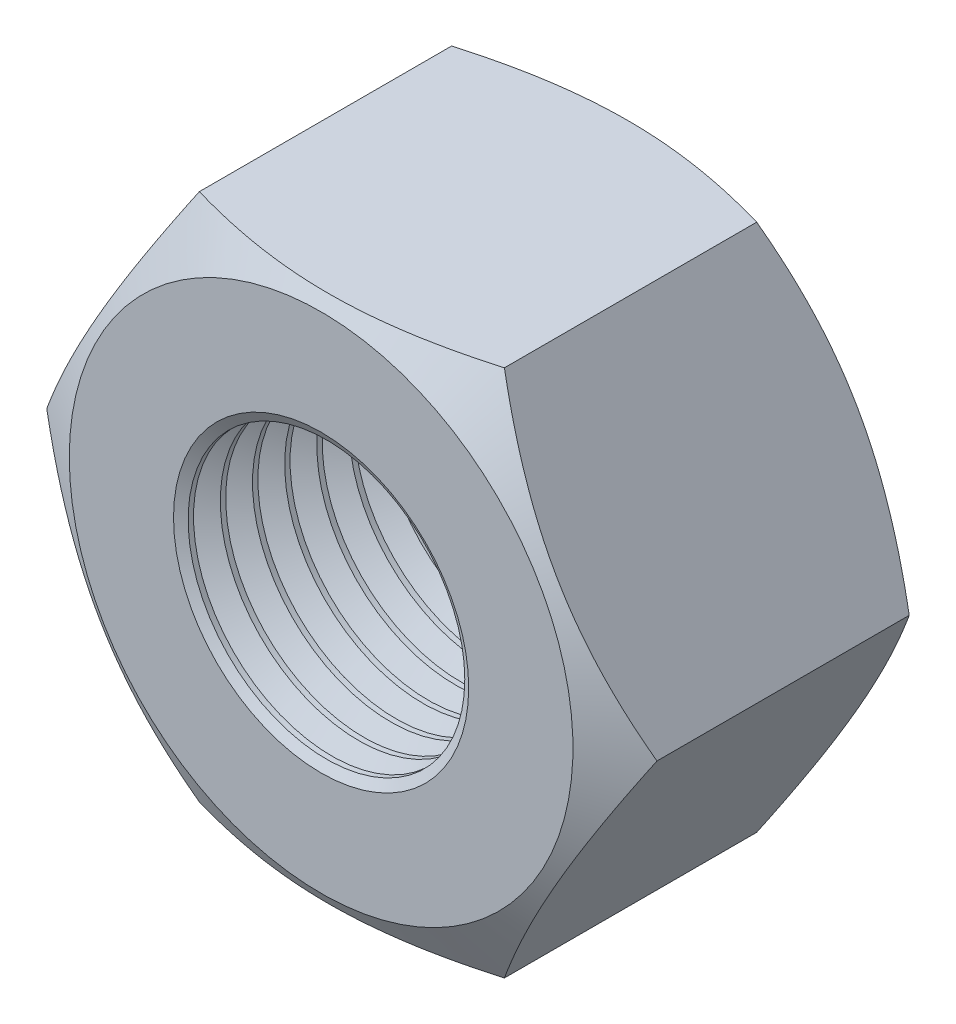
from build123d import *

# Parameters (mm, degrees)
SKETCH1_R        = 4.188
BASENUT_DEPTH    = 9.5
LPATTERN10_COUNT = 11
LPATTERN10_PITCH = 0.9744


with BuildPart() as part:
    # Sketch1 → BaseNut (new body)
    with BuildSketch(Plane.XY):
        Polygon((4.618802154, -8), (9.237604307, 0), (4.618802154, 8), (-4.618802154, 8), (-9.237604307, 0), (-4.618802154, -8), align=None)
        Circle(SKETCH1_R, mode=Mode.SUBTRACT)
    extrude(amount=-BASENUT_DEPTH)

    # Sketch2 → Double-Chamfer (revolve, cut)
    with BuildSketch(Plane(origin=(0, 0, 0), x_dir=(1, 0, 0), z_dir=(0, 1, 0))):
        Polygon((-9.237604307, 9.5), (-7.625, 9.5), (-9.237604307, 8.568962469), align=None)
        Polygon((-9.237604307, 0.931037531), (-9.237604307, 0), (-7.625, 0), align=None)
    revolve(axis=Axis((0, 0, -3.375940562), (0, 0, 1)), mode=Mode.SUBTRACT)

    # Sketch4 → Cut-Revolve10 (revolve, cut)
    with BuildSketch(Plane(origin=(0, 0, 0), x_dir=(1, 0, 0), z_dir=(0, 1, 0))):
        Polygon((4.891212628, 9.5), (4.188, 9.094), (3.376, 9.094), (3.376, 9.906), (4.188, 9.906), align=None)
    cut_revolve10 = revolve(axis=Axis((0, 0, 0), (0, 0, -1)), mode=Mode.SUBTRACT)

    # LPattern10: Cut-Revolve10 ×11
    with Locations(*[(0, 0, i * LPATTERN10_PITCH) for i in range(1, LPATTERN10_COUNT)]):
        add(cut_revolve10, mode=Mode.SUBTRACT)


solid = part.part
